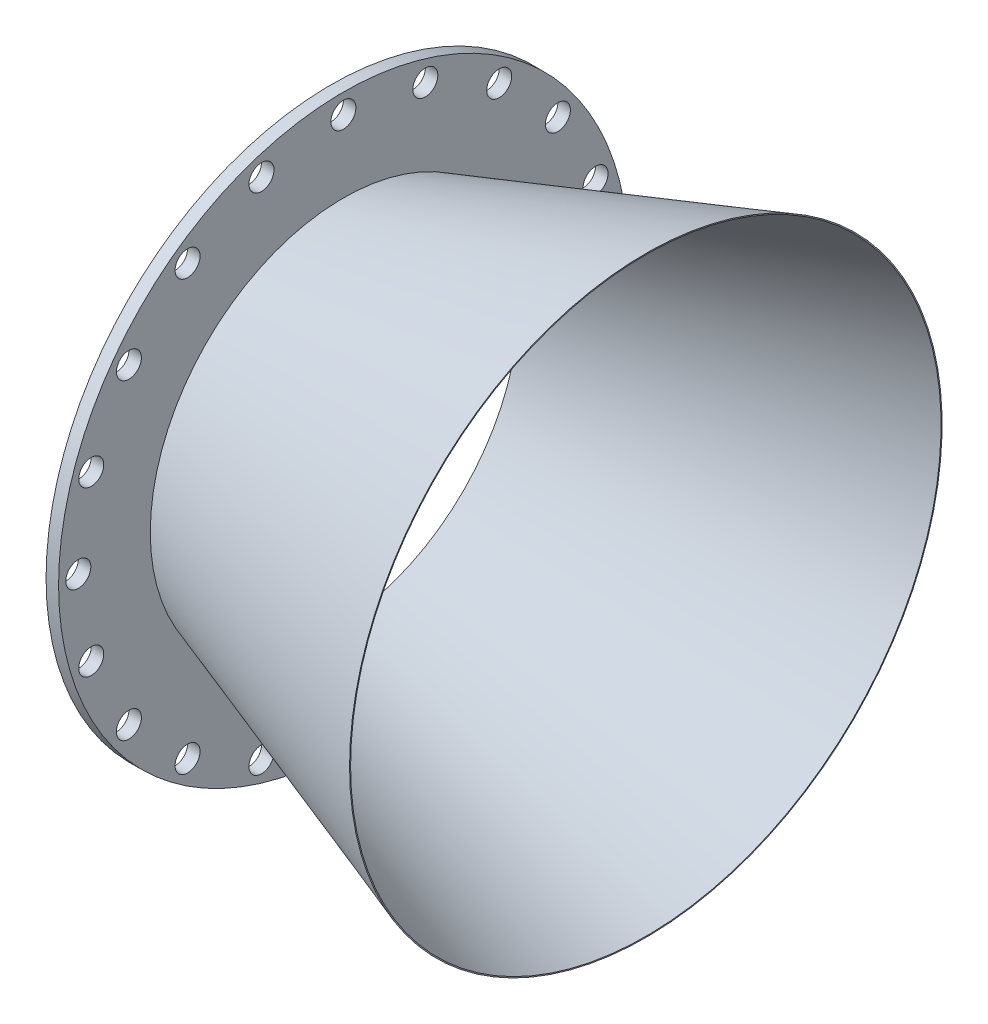
from build123d import *

# Parameters (mm, degrees)
CUT_EXTRUDE1_REACH = 135.082
SKETCH4_R          = 3.175


with BuildPart() as part:
    # Sketch1 → Revolve1 (revolve)
    with BuildSketch(Plane.XY, mode=Mode.PRIVATE) as revolve1_sk:
        Polygon((0, 47.6758), (79.9592, 74.9554), (79.9592, 75.223775525), (0, 47.944175525), align=None)
    revolve(revolve1_sk.sketch.rotate(Axis((0, 0, 0), (1, 0, 0)), 90), axis=Axis((0, 0, 0), (1, 0, 0)))

    # Sketch3 → Revolve2 (revolve)
    with BuildSketch(Plane.XY, mode=Mode.PRIVATE) as revolve2_sk:
        Polygon((0, 47.944175525), (3.175, 49.027387088), (3.175, 72.3138), (0, 72.3138), align=None)
    revolve(revolve2_sk.sketch.rotate(Axis((0, 0, 0), (1, 0, 0)), 90), axis=Axis((0, 0, 0), (1, 0, 0)))

    # Sketch4 → Cut-Extrude1 (cut, up to next)
    with BuildSketch(Plane.ZY, mode=Mode.PRIVATE) as cut_extrude1_sk1:
        with Locations((0, 67.31)):
            Circle(SKETCH4_R)
    cut_extrude1_tool1 = extrude(cut_extrude1_sk1.sketch, amount=-CUT_EXTRUDE1_REACH, mode=Mode.PRIVATE) & part.part
    # Sketch4 → Cut-Extrude1 (cut, up to next)
    with BuildSketch(Plane.ZY, mode=Mode.PRIVATE) as cut_extrude1_sk2:
        with Locations((20.799933891, 64.015614112)):
            Circle(SKETCH4_R)
    cut_extrude1_tool2 = extrude(cut_extrude1_sk2.sketch, amount=-CUT_EXTRUDE1_REACH, mode=Mode.PRIVATE) & part.part
    # Sketch4 → Cut-Extrude1 (cut, up to next)
    with BuildSketch(Plane.ZY, mode=Mode.PRIVATE) as cut_extrude1_sk3:
        with Locations((39.563825332, 54.454933891)):
            Circle(SKETCH4_R)
    cut_extrude1_tool3 = extrude(cut_extrude1_sk3.sketch, amount=-CUT_EXTRUDE1_REACH, mode=Mode.PRIVATE) & part.part
    # Sketch4 → Cut-Extrude1 (cut, up to next)
    with BuildSketch(Plane.ZY, mode=Mode.PRIVATE) as cut_extrude1_sk4:
        with Locations((54.454933891, 39.563825332)):
            Circle(SKETCH4_R)
    cut_extrude1_tool4 = extrude(cut_extrude1_sk4.sketch, amount=-CUT_EXTRUDE1_REACH, mode=Mode.PRIVATE) & part.part
    # Sketch4 → Cut-Extrude1 (cut, up to next)
    with BuildSketch(Plane.ZY, mode=Mode.PRIVATE) as cut_extrude1_sk5:
        with Locations((64.015614112, 20.799933891)):
            Circle(SKETCH4_R)
    cut_extrude1_tool5 = extrude(cut_extrude1_sk5.sketch, amount=-CUT_EXTRUDE1_REACH, mode=Mode.PRIVATE) & part.part
    # Sketch4 → Cut-Extrude1 (cut, up to next)
    with BuildSketch(Plane.ZY, mode=Mode.PRIVATE) as cut_extrude1_sk6:
        with Locations((67.31, 0)):
            Circle(SKETCH4_R)
    cut_extrude1_tool6 = extrude(cut_extrude1_sk6.sketch, amount=-CUT_EXTRUDE1_REACH, mode=Mode.PRIVATE) & part.part
    # Sketch4 → Cut-Extrude1 (cut, up to next)
    with BuildSketch(Plane.ZY, mode=Mode.PRIVATE) as cut_extrude1_sk7:
        with Locations((64.015614112, -20.799933891)):
            Circle(SKETCH4_R)
    cut_extrude1_tool7 = extrude(cut_extrude1_sk7.sketch, amount=-CUT_EXTRUDE1_REACH, mode=Mode.PRIVATE) & part.part
    # Sketch4 → Cut-Extrude1 (cut, up to next)
    with BuildSketch(Plane.ZY, mode=Mode.PRIVATE) as cut_extrude1_sk8:
        with Locations((54.454933891, -39.563825332)):
            Circle(SKETCH4_R)
    cut_extrude1_tool8 = extrude(cut_extrude1_sk8.sketch, amount=-CUT_EXTRUDE1_REACH, mode=Mode.PRIVATE) & part.part
    # Sketch4 → Cut-Extrude1 (cut, up to next)
    with BuildSketch(Plane.ZY, mode=Mode.PRIVATE) as cut_extrude1_sk9:
        with Locations((39.563825332, -54.454933891)):
            Circle(SKETCH4_R)
    cut_extrude1_tool9 = extrude(cut_extrude1_sk9.sketch, amount=-CUT_EXTRUDE1_REACH, mode=Mode.PRIVATE) & part.part
    # Sketch4 → Cut-Extrude1 (cut, up to next)
    with BuildSketch(Plane.ZY, mode=Mode.PRIVATE) as cut_extrude1_sk10:
        with Locations((20.799933891, -64.015614112)):
            Circle(SKETCH4_R)
    cut_extrude1_tool10 = extrude(cut_extrude1_sk10.sketch, amount=-CUT_EXTRUDE1_REACH, mode=Mode.PRIVATE) & part.part
    # Sketch4 → Cut-Extrude1 (cut, up to next)
    with BuildSketch(Plane.ZY, mode=Mode.PRIVATE) as cut_extrude1_sk11:
        with Locations((0, -67.31)):
            Circle(SKETCH4_R)
    cut_extrude1_tool11 = extrude(cut_extrude1_sk11.sketch, amount=-CUT_EXTRUDE1_REACH, mode=Mode.PRIVATE) & part.part
    # Sketch4 → Cut-Extrude1 (cut, up to next)
    with BuildSketch(Plane.ZY, mode=Mode.PRIVATE) as cut_extrude1_sk12:
        with Locations((-20.799933891, -64.015614112)):
            Circle(SKETCH4_R)
    cut_extrude1_tool12 = extrude(cut_extrude1_sk12.sketch, amount=-CUT_EXTRUDE1_REACH, mode=Mode.PRIVATE) & part.part
    # Sketch4 → Cut-Extrude1 (cut, up to next)
    with BuildSketch(Plane.ZY, mode=Mode.PRIVATE) as cut_extrude1_sk13:
        with Locations((-39.563825332, -54.454933891)):
            Circle(SKETCH4_R)
    cut_extrude1_tool13 = extrude(cut_extrude1_sk13.sketch, amount=-CUT_EXTRUDE1_REACH, mode=Mode.PRIVATE) & part.part
    # Sketch4 → Cut-Extrude1 (cut, up to next)
    with BuildSketch(Plane.ZY, mode=Mode.PRIVATE) as cut_extrude1_sk14:
        with Locations((-54.454933891, -39.563825332)):
            Circle(SKETCH4_R)
    cut_extrude1_tool14 = extrude(cut_extrude1_sk14.sketch, amount=-CUT_EXTRUDE1_REACH, mode=Mode.PRIVATE) & part.part
    # Sketch4 → Cut-Extrude1 (cut, up to next)
    with BuildSketch(Plane.ZY, mode=Mode.PRIVATE) as cut_extrude1_sk15:
        with Locations((-64.015614112, -20.799933891)):
            Circle(SKETCH4_R)
    cut_extrude1_tool15 = extrude(cut_extrude1_sk15.sketch, amount=-CUT_EXTRUDE1_REACH, mode=Mode.PRIVATE) & part.part
    # Sketch4 → Cut-Extrude1 (cut, up to next)
    with BuildSketch(Plane.ZY, mode=Mode.PRIVATE) as cut_extrude1_sk16:
        with Locations((-67.31, 0)):
            Circle(SKETCH4_R)
    cut_extrude1_tool16 = extrude(cut_extrude1_sk16.sketch, amount=-CUT_EXTRUDE1_REACH, mode=Mode.PRIVATE) & part.part
    # Sketch4 → Cut-Extrude1 (cut, up to next)
    with BuildSketch(Plane.ZY, mode=Mode.PRIVATE) as cut_extrude1_sk17:
        with Locations((-64.015614112, 20.799933891)):
            Circle(SKETCH4_R)
    cut_extrude1_tool17 = extrude(cut_extrude1_sk17.sketch, amount=-CUT_EXTRUDE1_REACH, mode=Mode.PRIVATE) & part.part
    # Sketch4 → Cut-Extrude1 (cut, up to next)
    with BuildSketch(Plane.ZY, mode=Mode.PRIVATE) as cut_extrude1_sk18:
        with Locations((-54.454933891, 39.563825332)):
            Circle(SKETCH4_R)
    cut_extrude1_tool18 = extrude(cut_extrude1_sk18.sketch, amount=-CUT_EXTRUDE1_REACH, mode=Mode.PRIVATE) & part.part
    # Sketch4 → Cut-Extrude1 (cut, up to next)
    with BuildSketch(Plane.ZY, mode=Mode.PRIVATE) as cut_extrude1_sk19:
        with Locations((-39.563825332, 54.454933891)):
            Circle(SKETCH4_R)
    cut_extrude1_tool19 = extrude(cut_extrude1_sk19.sketch, amount=-CUT_EXTRUDE1_REACH, mode=Mode.PRIVATE) & part.part
    # Sketch4 → Cut-Extrude1 (cut, up to next)
    with BuildSketch(Plane.ZY, mode=Mode.PRIVATE) as cut_extrude1_sk20:
        with Locations((-20.799933891, 64.015614112)):
            Circle(SKETCH4_R)
    cut_extrude1_tool20 = extrude(cut_extrude1_sk20.sketch, amount=-CUT_EXTRUDE1_REACH, mode=Mode.PRIVATE) & part.part
    add(cut_extrude1_tool1.solids().sort_by_distance((0, 67.31, 0))[0], mode=Mode.SUBTRACT)
    add(cut_extrude1_tool2.solids().sort_by_distance((0, 64.015614, 20.799934))[0], mode=Mode.SUBTRACT)
    add(cut_extrude1_tool3.solids().sort_by_distance((0, 54.454934, 39.563825))[0], mode=Mode.SUBTRACT)
    add(cut_extrude1_tool4.solids().sort_by_distance((0, 39.563825, 54.454934))[0], mode=Mode.SUBTRACT)
    add(cut_extrude1_tool5.solids().sort_by_distance((0, 20.799934, 64.015614))[0], mode=Mode.SUBTRACT)
    add(cut_extrude1_tool6.solids().sort_by_distance((0, 0, 67.31))[0], mode=Mode.SUBTRACT)
    add(cut_extrude1_tool7.solids().sort_by_distance((0, -20.799934, 64.015614))[0], mode=Mode.SUBTRACT)
    add(cut_extrude1_tool8.solids().sort_by_distance((0, -39.563825, 54.454934))[0], mode=Mode.SUBTRACT)
    add(cut_extrude1_tool9.solids().sort_by_distance((0, -54.454934, 39.563825))[0], mode=Mode.SUBTRACT)
    add(cut_extrude1_tool10.solids().sort_by_distance((0, -64.015614, 20.799934))[0], mode=Mode.SUBTRACT)
    add(cut_extrude1_tool11.solids().sort_by_distance((0, -67.31, 0))[0], mode=Mode.SUBTRACT)
    add(cut_extrude1_tool12.solids().sort_by_distance((0, -64.015614, -20.799934))[0], mode=Mode.SUBTRACT)
    add(cut_extrude1_tool13.solids().sort_by_distance((0, -54.454934, -39.563825))[0], mode=Mode.SUBTRACT)
    add(cut_extrude1_tool14.solids().sort_by_distance((0, -39.563825, -54.454934))[0], mode=Mode.SUBTRACT)
    add(cut_extrude1_tool15.solids().sort_by_distance((0, -20.799934, -64.015614))[0], mode=Mode.SUBTRACT)
    add(cut_extrude1_tool16.solids().sort_by_distance((0, 0, -67.31))[0], mode=Mode.SUBTRACT)
    add(cut_extrude1_tool17.solids().sort_by_distance((0, 20.799934, -64.015614))[0], mode=Mode.SUBTRACT)
    add(cut_extrude1_tool18.solids().sort_by_distance((0, 39.563825, -54.454934))[0], mode=Mode.SUBTRACT)
    add(cut_extrude1_tool19.solids().sort_by_distance((0, 54.454934, -39.563825))[0], mode=Mode.SUBTRACT)
    add(cut_extrude1_tool20.solids().sort_by_distance((0, 64.015614, -20.799934))[0], mode=Mode.SUBTRACT)


solid = part.part
